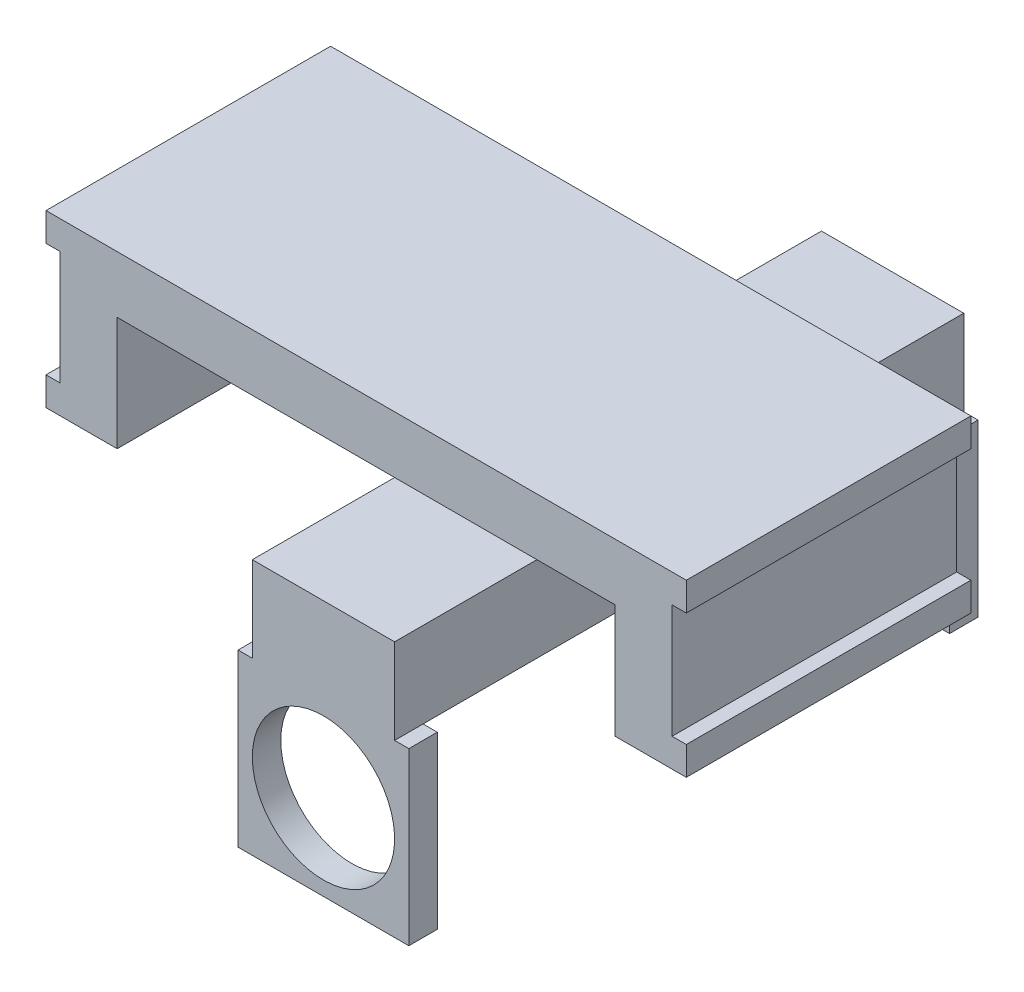
from build123d import *

# Parameters (mm, degrees)
SKETCH1_W           = 57.15
SKETCH1_H           = 25.4
BOSS_EXTRUDE1_DEPTH = 15.24
SKETCH2_W           = 44.45
SKETCH2_H           = 25.4
CUT_EXTRUDE1_DEPTH  = 10.16
SKETCH3_W           = 1.27
SKETCH3_H           = 10.16
CUT_EXTRUDE2_DEPTH  = 42.157602275
BOSS_EXTRUDE2_START = -10.16
SKETCH4_W           = 12.7
SKETCH4_H           = 50.8
BOSS_EXTRUDE2_DEPTH = 7.62
SKETCH6_W           = 15.24
SKETCH6_H           = 15.24
SKETCH6_R           = 6.35
BOSS_EXTRUDE3_DEPTH = 2.54


with BuildPart() as part:
    # Sketch1 → Boss-Extrude1 (new body)
    with BuildSketch(Plane(origin=(0, 0, 0), x_dir=(1, 0, 0), z_dir=(0, 1, 0))):
        Rectangle(SKETCH1_W, SKETCH1_H)
    extrude(amount=BOSS_EXTRUDE1_DEPTH)

    # Sketch2 → Cut-Extrude1 (cut)
    with BuildSketch(Plane.XZ):
        Rectangle(SKETCH2_W, SKETCH2_H)
    extrude(amount=-CUT_EXTRUDE1_DEPTH, mode=Mode.SUBTRACT)

    # Sketch3 → Cut-Extrude2 (cut, through all)
    with BuildSketch(Plane.XY.offset(12.7)):
        with Locations((-27.94, 7.62)):
            Rectangle(SKETCH3_W, SKETCH3_H)
        with Locations((27.94, 7.62)):
            Rectangle(SKETCH3_W, SKETCH3_H)
    extrude(amount=-CUT_EXTRUDE2_DEPTH, mode=Mode.SUBTRACT)

    # Sketch4 → Boss-Extrude2 (add)
    with BuildSketch(Plane.XZ.offset(BOSS_EXTRUDE2_START)):
        with Locations((8.89, 0)):
            Rectangle(SKETCH4_W, SKETCH4_H)
    extrude(amount=BOSS_EXTRUDE2_DEPTH)

    # Sketch6 → Boss-Extrude3 (add)
    with BuildSketch(Plane(origin=(0, 0, -25.4), x_dir=(-1, 0, 0), z_dir=(0, 0, -1))):
        with Locations((-8.89, -5.08)):
            Rectangle(SKETCH6_W, SKETCH6_H)
        with Locations((-8.89, -5.08)):
            Circle(SKETCH6_R, mode=Mode.SUBTRACT)
    boss_extrude3 = extrude(amount=-BOSS_EXTRUDE3_DEPTH)

    # Mirror1: Boss-Extrude3 across plane
    add(boss_extrude3.mirror(Plane.XY))


solid = part.part
